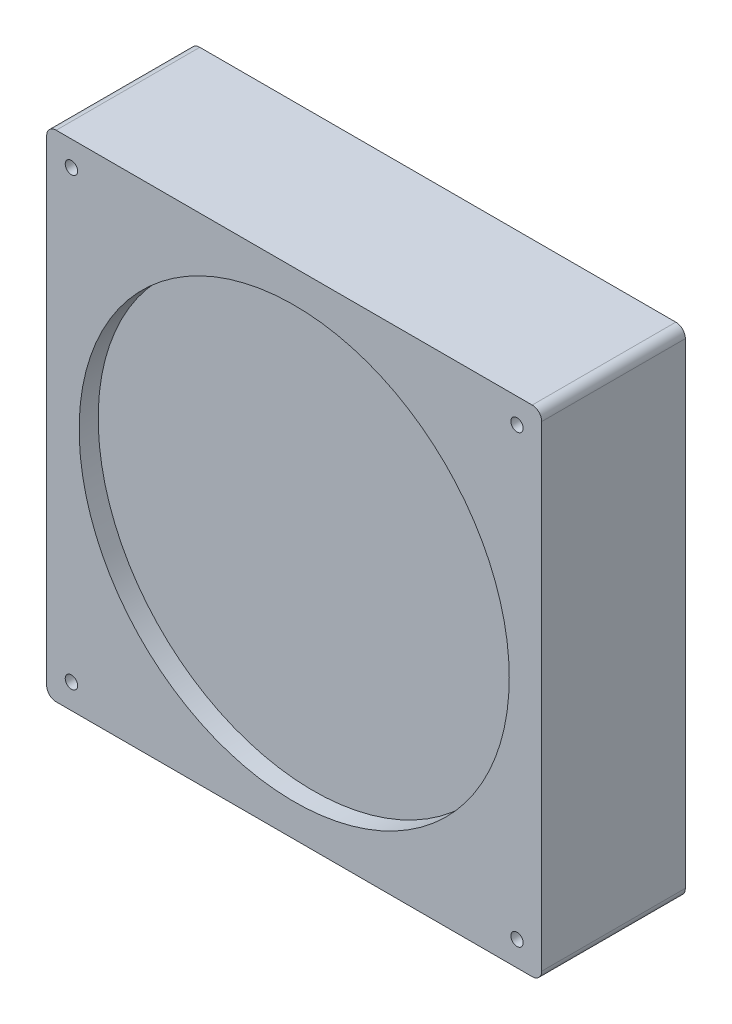
from build123d import *

# Parameters (mm, degrees)
SKETCH1_W             = 132
SKETCH1_H             = 132
BOSS_EXTRUDE1_DEPTH   = 38.29
FILLET1_R             = 2.54
M4X0_7_TAPPED_HOLE1_D = 3.3
SKETCH4_R             = 57.341527379
CUT_EXTRUDE1_DEPTH    = 5.08


with BuildPart() as part:
    # Sketch1 → Boss-Extrude1 (new body)
    with BuildSketch(Plane.XY):
        Rectangle(SKETCH1_W, SKETCH1_H)
    extrude(amount=BOSS_EXTRUDE1_DEPTH)

    # Fillet1
    fillet1_edges = [part.edges().sort_by_distance(p)[0] for p in [
        (66, -66, 19.145),
        (-66, -66, 19.145),
        (-66, 66, 19.145),
        (66, 66, 19.145),
    ]]
    fillet(fillet1_edges, radius=FILLET1_R)

    # M4x0.7 Tapped Hole1 (through all)
    with Locations(Plane.XY.offset(38.29)):
        with Locations((-59.4, 59.4), (59.4, 59.4), (59.4, -59.4), (-59.4, -59.4)):
            Hole(M4X0_7_TAPPED_HOLE1_D / 2)

    # Sketch4 → Cut-Extrude1 (cut)
    with BuildSketch(Plane.XY.offset(38.29)):
        Circle(SKETCH4_R)
    extrude(amount=-CUT_EXTRUDE1_DEPTH, mode=Mode.SUBTRACT)


solid = part.part
